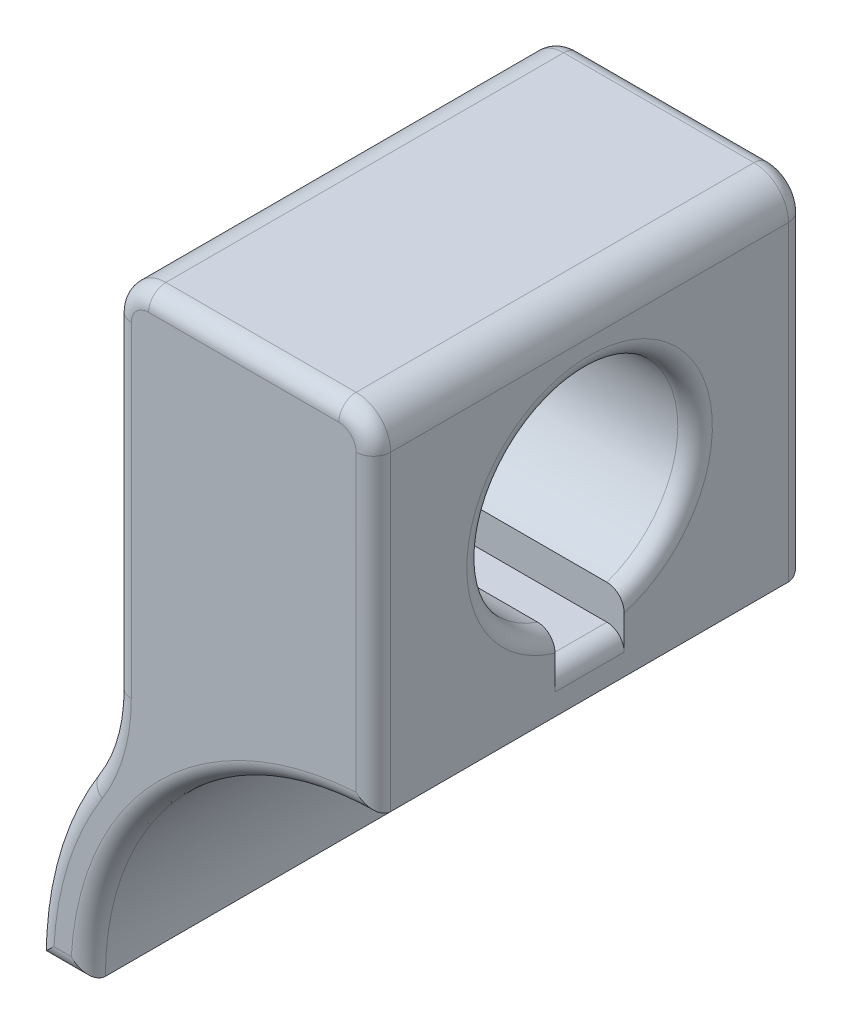
from build123d import *

# Parameters (mm, degrees)
BOSS_EXTRUDE1_DEPTH = 25
CUT_EXTRUDE1_DEPTH  = 49.347699015
FILLET1_R           = 1
FILLET2_R           = 1
FILLET3_R           = 1


with BuildPart() as part:
    # Sketch1 → Boss-Extrude1 (new body)
    with BuildSketch(Plane.XY):
        with BuildLine():
            Line((-19.5, 0), (-16.5, 0))
            ThreePointArc((-16.5, 0), (-11.66726189, 11.66726189), (0, 16.5))
            Line((0, 16.5), (0, 34.5))
            ThreePointArc((0, 34.5), (-0.585786438, 35.914213562), (-2, 36.5))
            Line((-2, 36.5), (-13, 36.5))
            ThreePointArc((-13, 36.5), (-14.414213562, 35.914213562), (-15, 34.5))
            Line((-15, 34.5), (-15, 15.660459763))
            ThreePointArc((-15, 15.660459763), (-15.388918825, 12.89873591), (-16.525423729, 10.351829335))
            ThreePointArc((-16.525423729, 10.351829335), (-18.741608292, 5.385361515), (-19.5, 0))
        make_face()
    extrude(amount=BOSS_EXTRUDE1_DEPTH)

    # Sketch2 → Cut-Extrude1 (cut, through all)
    with BuildSketch(Plane(origin=(0, 0, 0), x_dir=(0, 0, -1), z_dir=(1, 0, 0))):
        with BuildLine():
            Line((-14.5, 18.737188186), (-10.5, 18.737188186))
            Line((-10.5, 18.737188186), (-10.5, 20.737188186))
            ThreePointArc((-10.5, 20.737188186), (-12.5, 32.6), (-14.5, 20.737188186))
            Line((-14.5, 20.737188186), (-14.5, 18.737188186))
        make_face()
    extrude(amount=-CUT_EXTRUDE1_DEPTH, mode=Mode.SUBTRACT)

    # Fillet1
    fillet1_edges = [part.edges().sort_by_distance(p)[0] for p in [
        (-15, 18.737188186, 12.5),
        (0, 18.737188186, 12.5),
    ]]
    fillet(fillet1_edges, radius=FILLET1_R)

    # Fillet2
    fillet2_edges = [part.edges().sort_by_distance(p)[0] for p in [
        (-15, 32.6, 12.5),
        (0, 32.6, 12.5),
    ]]
    fillet(fillet2_edges, radius=FILLET2_R)

    # Fillet3
    fillet3_edges = [part.edges().sort_by_distance(p)[0] for p in [
        (-11.66726189, 11.66726189, 25),
        (-0.585786438, 35.914213562, 0),
        (0, 25.5, 0),
        (-11.66726189, 11.66726189, 0),
        (-18, 0, 0),
        (-18.741608292, 5.385361515, 0),
        (0, 25.5, 25),
        (-0.585786438, 35.914213562, 25),
        (-7.5, 36.5, 25),
        (-14.414213562, 35.914213562, 25),
        (-15, 25.080229882, 25),
        (-15.388918825, 12.89873591, 25),
        (-18.741608292, 5.385361515, 25),
        (-18, 0, 25),
        (-15.388918825, 12.89873591, 0),
        (-15, 25.080229882, 0),
        (-14.414213562, 35.914213562, 0),
        (-7.5, 36.5, 0),
    ]]
    fillet(fillet3_edges, radius=FILLET3_R)


solid = part.part
